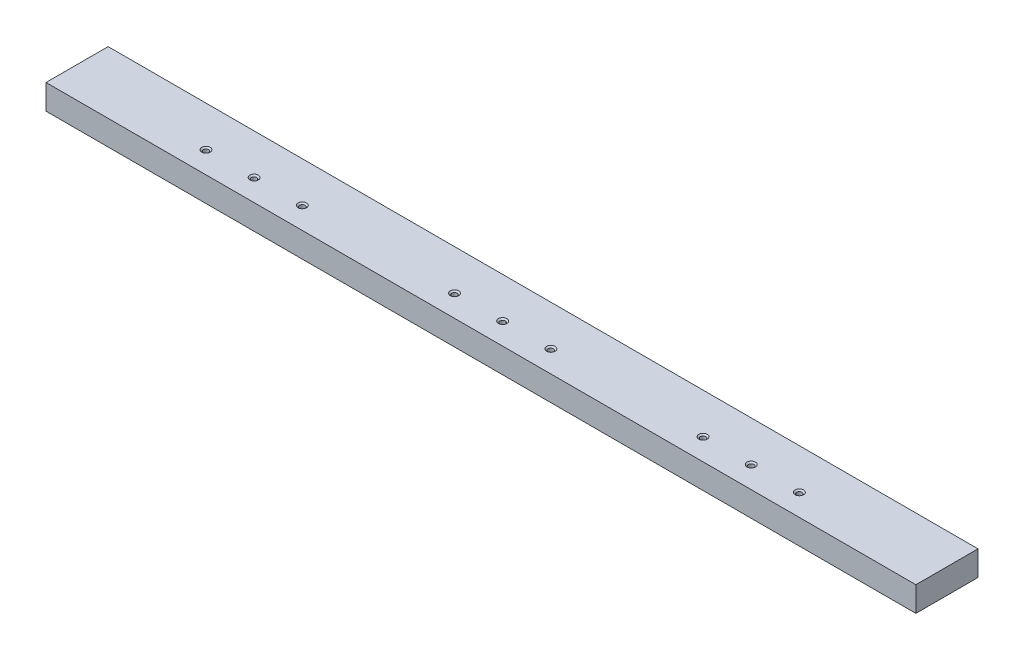
from build123d import *

# Parameters (mm, degrees)
SKETCH1_W                       = 560
SKETCH1_H                       = 40
BOSS_EXTRUDE1_DEPTH             = 8
F_8_36_TAPPED_HOLE1_D           = 3.4544
F_8_36_TAPPED_HOLE1_CSINK_D     = 5.4356
F_8_36_TAPPED_HOLE1_CSINK_ANGLE = 100
LPATTERN1_COUNT                 = 3
LPATTERN1_PITCH                 = 160


with BuildPart() as part:
    # Sketch1 → Boss-Extrude1 (new, symmetric)
    with BuildSketch(Plane(origin=(0, 0, 0), x_dir=(1, 0, 0), z_dir=(0, 1, 0))):
        Rectangle(SKETCH1_W, SKETCH1_H)
    extrude(amount=BOSS_EXTRUDE1_DEPTH, both=True)

    # #8-36 Tapped Hole1 (through all)
    with Locations(Plane(origin=(0, 8, 0), x_dir=(1, 0, 0), z_dir=(0, 1, 0))):
        with Locations((191, -6), (160, -6), (129, -6)):
            f_8_36_tapped_hole1 = CounterSinkHole(F_8_36_TAPPED_HOLE1_D / 2, F_8_36_TAPPED_HOLE1_CSINK_D / 2, counter_sink_angle=F_8_36_TAPPED_HOLE1_CSINK_ANGLE)

    # LPattern1: #8-36 Tapped Hole1 ×3
    with Locations(*[(-i * LPATTERN1_PITCH, 0, 0) for i in range(1, LPATTERN1_COUNT)]):
        add(f_8_36_tapped_hole1, mode=Mode.SUBTRACT)


solid = part.part
